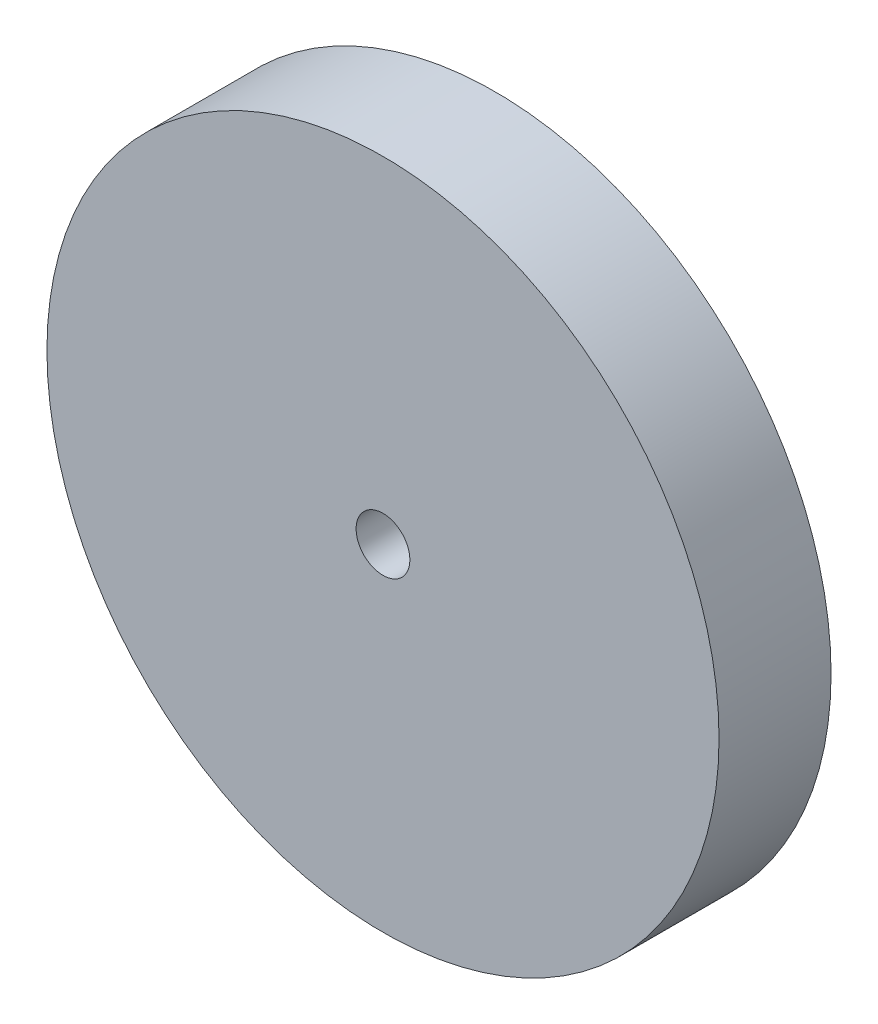
from build123d import *

# Parameters (mm, degrees)
SKETCH1_R           = 15
SKETCH1_R_2         = 1.2
BOSS_EXTRUDE1_DEPTH = 5


with BuildPart() as part:
    # Sketch1 → Boss-Extrude1 (new body)
    with BuildSketch(Plane.XY):
        Circle(SKETCH1_R)
        Circle(SKETCH1_R_2, mode=Mode.SUBTRACT)
    extrude(amount=BOSS_EXTRUDE1_DEPTH)


solid = part.part
